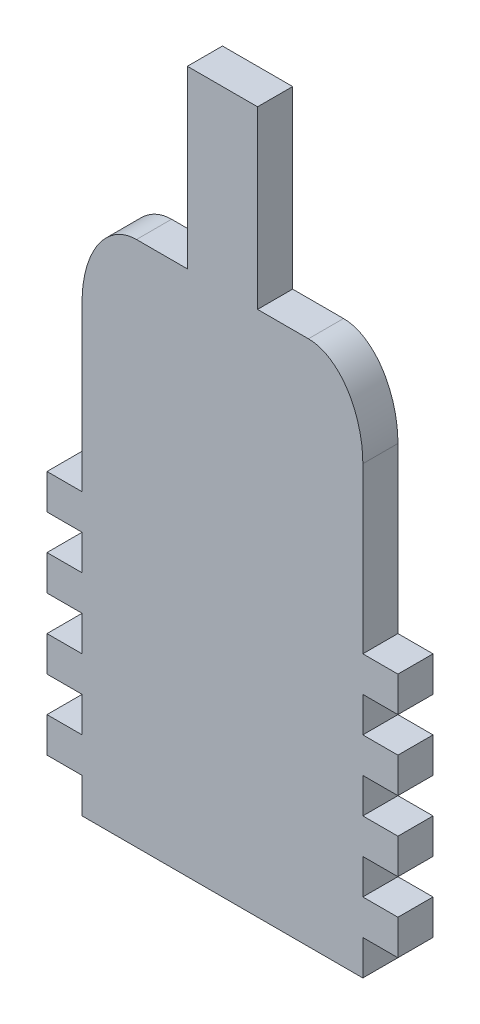
from build123d import *

# Parameters (mm, degrees)
BOSS_EXTRU_1_DEPTH = 5


with BuildPart() as part:
    # Esquisse1 → Boss.-Extru.1 (new body)
    with BuildSketch(Plane.XY):
        with BuildLine():
            Line((-88.421426264, 20.834954052), (-88.421426264, 25.834954052))
            Line((-88.421426264, 25.834954052), (-93.421426264, 25.834954052))
            Line((-93.421426264, 25.834954052), (-93.421426264, 30.834954052))
            Line((-93.421426264, 30.834954052), (-88.421426264, 30.834954052))
            Line((-88.421426264, 30.834954052), (-88.421426264, 35.834954052))
            Line((-88.421426264, 35.834954052), (-93.421426264, 35.834954052))
            Line((-93.421426264, 35.834954052), (-93.421426264, 40.834954052))
            Line((-93.421426264, 40.834954052), (-88.421426264, 40.834954052))
            Line((-88.421426264, 40.834954052), (-88.421426264, 45.834954052))
            Line((-88.421426264, 45.834954052), (-93.421426264, 45.834954052))
            Line((-93.421426264, 45.834954052), (-93.421426264, 50.834954052))
            Line((-93.421426264, 50.834954052), (-88.421426264, 50.834954052))
            Line((-88.421426264, 50.834954052), (-88.421426264, 55.834954052))
            Line((-88.421426264, 55.834954052), (-93.421426264, 55.834954052))
            Line((-93.421426264, 55.834954052), (-93.421426264, 60.834954052))
            Line((-93.421426264, 60.834954052), (-88.421426264, 60.834954052))
            Line((-88.421426264, 60.834954052), (-88.421426264, 84.288786066))
            add(Edge.make_bspline(
                [(-80.671426264, 95.834954052), (-88.421426264, 95.834954052), (-88.421426264, 84.288786066)],
                knots=[3.141592654, 3.141592654, 3.141592654, 4.71238898, 4.71238898, 4.71238898], degree=2, weights=[1, 0.707106781, 1]))
            Line((-80.671426264, 95.834954052), (-73.421426264, 95.834954052))
            Line((-73.421426264, 95.834954052), (-73.421426264, 120.834954052))
            Line((-73.421426264, 120.834954052), (-63.421426264, 120.834954052))
            Line((-63.421426264, 120.834954052), (-63.421426264, 95.834954052))
            Line((-63.421426264, 95.834954052), (-56.171426264, 95.834954052))
            add(Edge.make_bspline(
                [(-48.421426264, 84.288786066), (-48.421426264, 95.834954052), (-56.171426264, 95.834954052)],
                knots=[1.570796327, 1.570796327, 1.570796327, 3.141592654, 3.141592654, 3.141592654], degree=2, weights=[1, 0.707106781, 1]))
            Line((-48.421426264, 84.288786066), (-48.421426264, 60.834954052))
            Line((-48.421426264, 60.834954052), (-43.421426264, 60.834954052))
            Line((-43.421426264, 60.834954052), (-43.421426264, 55.834954052))
            Line((-43.421426264, 55.834954052), (-48.421426264, 55.834954052))
            Line((-48.421426264, 55.834954052), (-48.421426264, 50.834954052))
            Line((-48.421426264, 50.834954052), (-43.421426264, 50.834954052))
            Line((-43.421426264, 50.834954052), (-43.421426264, 45.834954052))
            Line((-43.421426264, 45.834954052), (-48.421426264, 45.834954052))
            Line((-48.421426264, 45.834954052), (-48.421426264, 40.834954052))
            Line((-48.421426264, 40.834954052), (-43.421426264, 40.834954052))
            Line((-43.421426264, 40.834954052), (-43.421426264, 35.834954052))
            Line((-43.421426264, 35.834954052), (-48.421426264, 35.834954052))
            Line((-48.421426264, 35.834954052), (-48.421426264, 30.834954052))
            Line((-48.421426264, 30.834954052), (-43.421426264, 30.834954052))
            Line((-43.421426264, 30.834954052), (-43.421426264, 25.834954052))
            Line((-43.421426264, 25.834954052), (-48.421426264, 25.834954052))
            Line((-48.421426264, 25.834954052), (-48.421426264, 20.834954052))
            Line((-48.421426264, 20.834954052), (-88.421426264, 20.834954052))
        make_face()
    extrude(amount=BOSS_EXTRU_1_DEPTH)


solid = part.part
